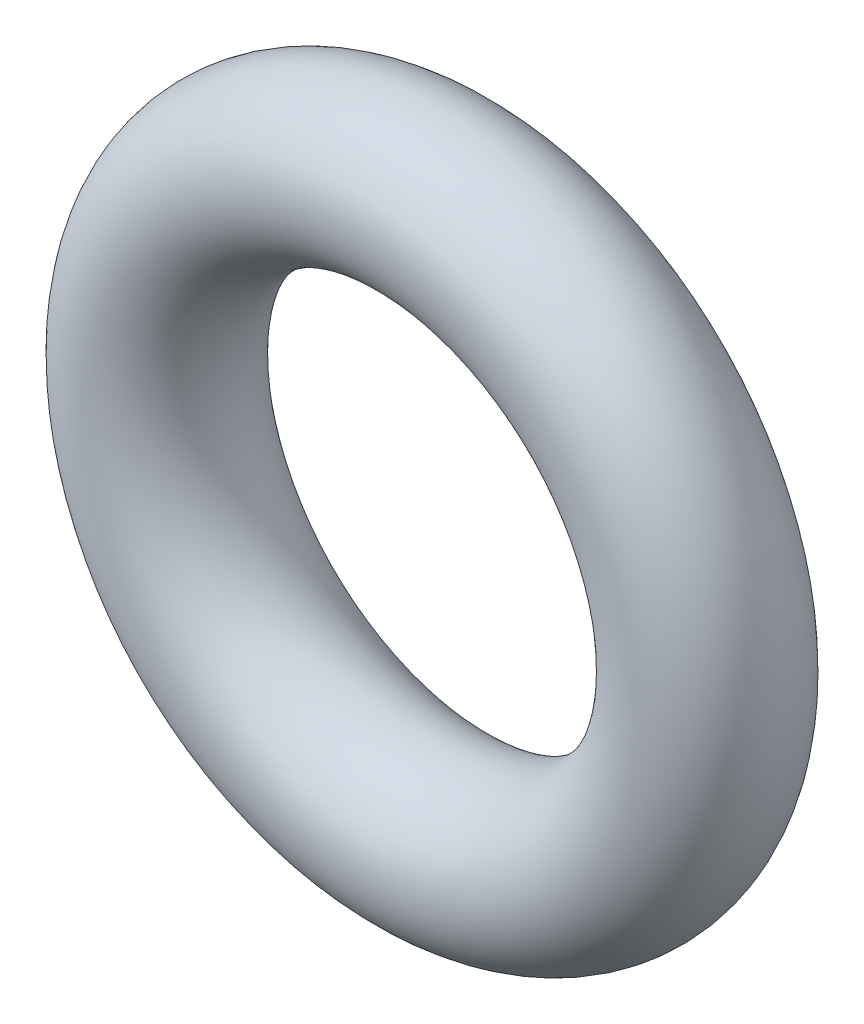
from build123d import *

# Parameters (mm, degrees)
SKETCH1_R = 0.89


with BuildPart() as part:
    # Sketch1 → Revolve1 (revolve)
    with BuildSketch(Plane(origin=(0, 0, 0), x_dir=(1, 0, 0), z_dir=(0, 1, 0))):
        with Locations((3.125, 0)):
            Circle(SKETCH1_R)
    revolve(axis=Axis((0, 0, 0), (0, 0, -1)))


solid = part.part
